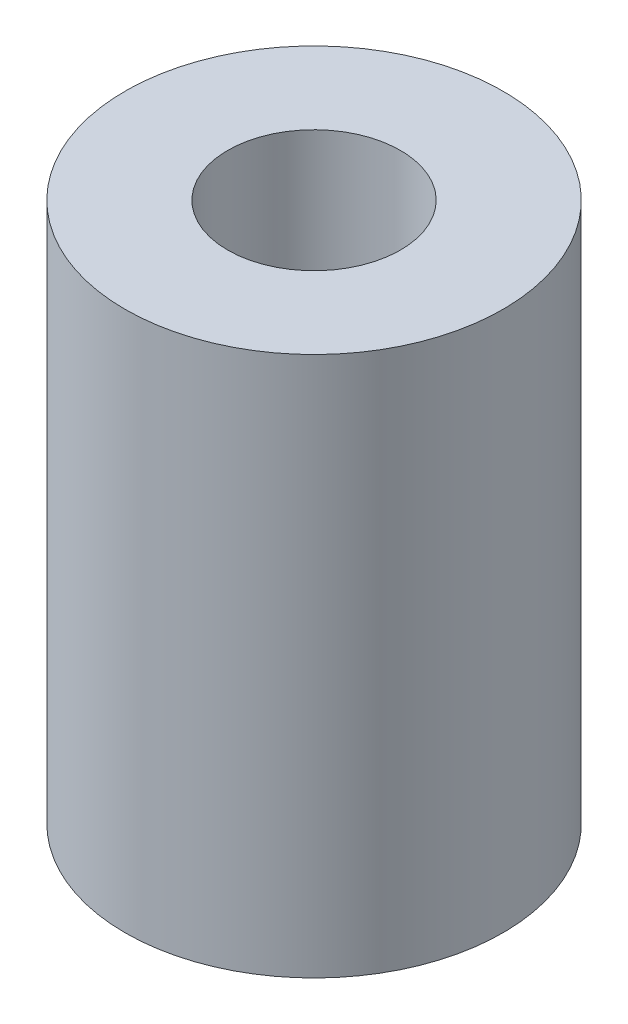
from build123d import *

# Parameters (mm, degrees)
ESBO_O1_R                = 3.5
ESBO_O1_R_2              = 1.6
RESSALTO_EXTRUS_O1_DEPTH = 5


with BuildPart() as part:
    # Esboço1 → Ressalto-extrusão1 (new, symmetric)
    with BuildSketch(Plane(origin=(0, 0, 0), x_dir=(1, 0, 0), z_dir=(0, 1, 0))):
        with Locations(Location((0, 0, 0), (0, 0, 270))):
            Circle(ESBO_O1_R)
        with Locations(Location((0, 0, 0), (0, 0, 270))):
            Circle(ESBO_O1_R_2, mode=Mode.SUBTRACT)
    extrude(amount=RESSALTO_EXTRUS_O1_DEPTH, both=True)


solid = part.part
